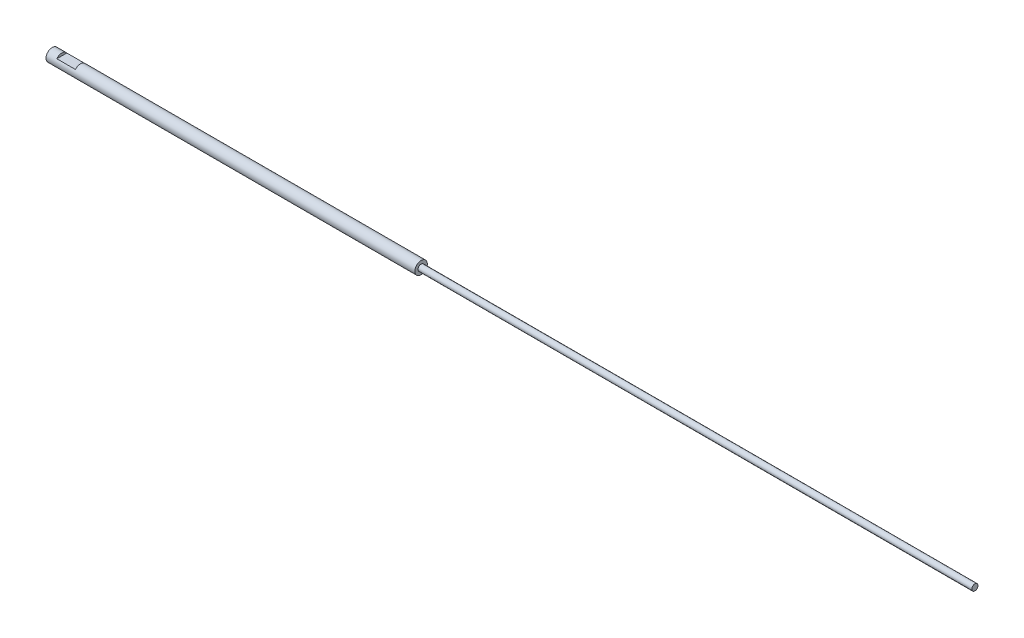
from build123d import *

# Parameters (mm, degrees)
SKICA2_R                 = 5
ODEBRAT_VYSUNUT_M1_DEPTH = 5
SKICA3_W                 = 15
SKICA3_H                 = 10
ODEBRAT_VYSUNUT_M2_DEPTH = 16


with BuildPart() as part:
    # Skica1 → Rotovat3 (revolve)
    with BuildSketch(Plane.XY, mode=Mode.PRIVATE) as rotovat3_sk:
        Polygon((301.25, 5), (0, 5), (0, 0), (745.975022487, 0), (745.975001326, 2.5), (301.25, 2.5), align=None)
    revolve(rotovat3_sk.sketch.rotate(Axis((256.066983307, 0, 0), (1, 0, 0)), 90), axis=Axis((256.066983307, 0, 0), (1, 0, 0)))

    # Skica2 → Odebrat vysunutím1 (cut)
    with BuildSketch(Plane.ZY):
        Circle(SKICA2_R)
    extrude(amount=-ODEBRAT_VYSUNUT_M1_DEPTH, mode=Mode.SUBTRACT)

    # Skica3 → Odebrat vysunutím2 (cut)
    with BuildSketch(Plane(origin=(0, 19, 0), x_dir=(1, 0, 0), z_dir=(0, 1, 0))):
        with Locations((20.207259422, 0)):
            Rectangle(SKICA3_W, SKICA3_H)
    extrude(amount=-ODEBRAT_VYSUNUT_M2_DEPTH, mode=Mode.SUBTRACT)


solid = part.part
